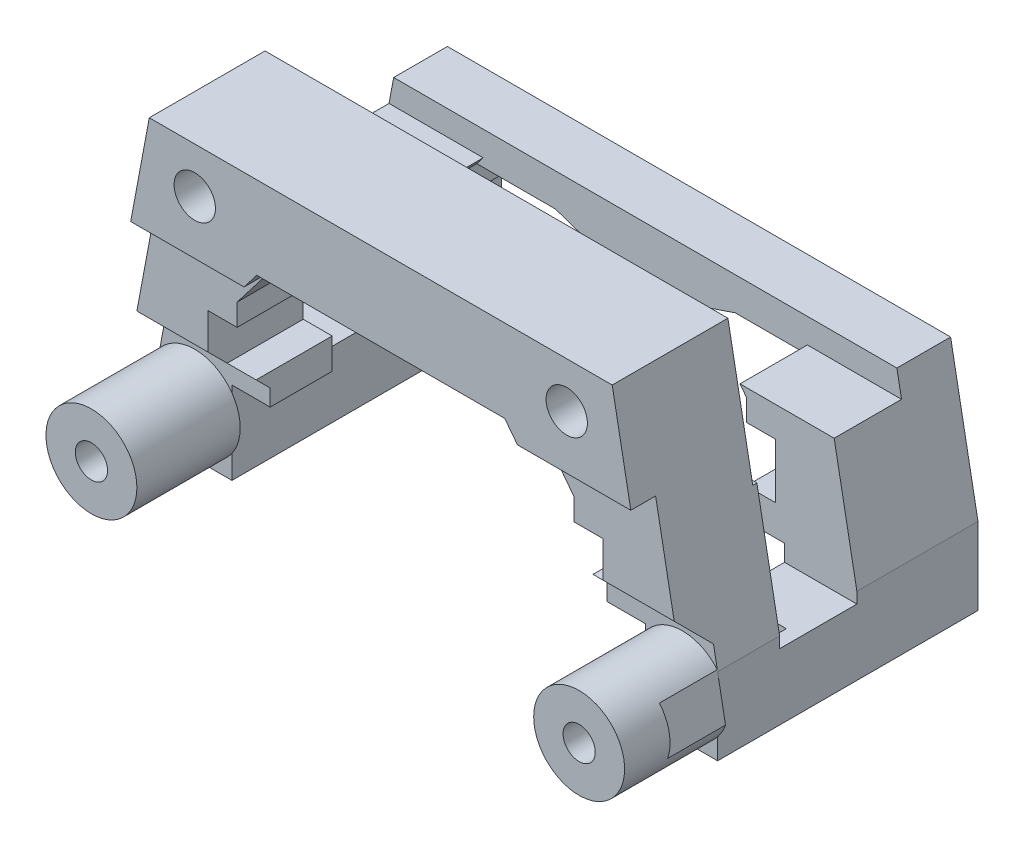
from build123d import *

# Parameters (mm, degrees)
SZKIC1_W                        = 1
SZKIC1_H                        = 32
DODANIE_WYCI_GNI_CIE1_DEPTH     = 67.5
WYTNIJ_WYCI_GNI_CIE1_DEPTH      = 94
WYTNIJ_WYCI_GNI_CIE2_DEPTH      = 36
WYTNIJ_WYCI_GNI_CIE2_DEPTH_BACK = 135
WYTNIJ_WYCI_GNI_CIE6_REACH      = 131.943
SZKIC6_R                        = 5
SZKIC7_R                        = 6.5
WYTNIJ_WYCI_GNI_CIE7_DEPTH      = 20
SZKIC8_R                        = 11
SZKIC8_R_2                      = 3.9
DODANIE_WYCI_GNI_CIE2_DEPTH     = 25
WYTNIJ_WYCI_GNI_CIE8_DEPTH      = 94


with BuildPart() as part:
    # Szkic1 → Dodanie-wyciągnięcie1 (new, symmetric)
    with BuildSketch(Plane(origin=(0, 0, 0), x_dir=(0, 0, -1), z_dir=(1, 0, 0))):
        Polygon((-63, 24), (-71, 32), (-71, 56), (-77, 56), (-77, 80), (-49, 80), (-49, 16), (-29.3, 16), (-29.3, 48), (-13, 48), (-13, 54), (0, 54), (0, 0), (-63, 0), align=None)
        with Locations((-48.5, 32)):
            Rectangle(SZKIC1_W, SZKIC1_H)
    extrude(amount=DODANIE_WYCI_GNI_CIE1_DEPTH, both=True)

    # Szkic2 → Wytnij-wyciągnięcie1 (cut)
    with BuildSketch(Plane(origin=(0, 0, 0), x_dir=(-1, 0, 0), z_dir=(0, 0, -1))):
        Polygon((50, 0), (50, 20), (40.75, 20), (40.75, 27.4), (47.75, 27.4), (47.75, 40.7), (40.75, 40.7), (40.75, 46), (21.75, 46), (10, 42), (-10, 42), (-21.75, 46), (-40.75, 46), (-40.75, 40.7), (-47.75, 40.7), (-47.75, 27.4), (-40.75, 27.4), (-40.75, 20), (-50, 20), (-50, 0), align=None)
    extrude(amount=-WYTNIJ_WYCI_GNI_CIE1_DEPTH, mode=Mode.SUBTRACT)

    # Szkic4 → Wytnij-wyciągnięcie2 (cut, two sides: drawn at the far end of the back side and taken through both)
    with BuildSketch(Plane(origin=(0, 0, 49), x_dir=(-1, 0, 0), z_dir=(0, 0, -1)).offset(-WYTNIJ_WYCI_GNI_CIE2_DEPTH_BACK)):
        Polygon((40.75, 40.7), (40.75, 46), (30, 60), (-30, 60), (-40.75, 46), (-40.75, 40.7), align=None)
    extrude(amount=WYTNIJ_WYCI_GNI_CIE2_DEPTH + WYTNIJ_WYCI_GNI_CIE2_DEPTH_BACK, mode=Mode.SUBTRACT)

    # Szkic6 → Wytnij-wyciągnięcie6 (cut, up to next)
    with BuildSketch(Plane.XY.offset(77), mode=Mode.PRIVATE) as wytnij_wyci_gni_cie6_sk1:
        with Locations((-45, 69)):
            Circle(SZKIC6_R)
    wytnij_wyci_gni_cie6_tool1 = extrude(wytnij_wyci_gni_cie6_sk1.sketch, amount=-WYTNIJ_WYCI_GNI_CIE6_REACH, mode=Mode.PRIVATE) & part.part
    # Szkic6 → Wytnij-wyciągnięcie6 (cut, up to next)
    with BuildSketch(Plane.XY.offset(77), mode=Mode.PRIVATE) as wytnij_wyci_gni_cie6_sk2:
        with Locations(Location((45, 69, 0), (0, 0, 270))):
            Circle(SZKIC6_R)
    wytnij_wyci_gni_cie6_tool2 = extrude(wytnij_wyci_gni_cie6_sk2.sketch, amount=-WYTNIJ_WYCI_GNI_CIE6_REACH, mode=Mode.PRIVATE) & part.part
    add(wytnij_wyci_gni_cie6_tool1.solids().sort_by_distance((-45, 69, 77))[0], mode=Mode.SUBTRACT)
    add(wytnij_wyci_gni_cie6_tool2.solids().sort_by_distance((45, 69, 77))[0], mode=Mode.SUBTRACT)

    # Szkic7 → Wytnij-wyciągnięcie7 (cut)
    with BuildSketch(Plane.XY.offset(63)):
        with Locations((-59, 12)):
            Circle(SZKIC7_R)
        with Locations(Location((59, 12, 0), (0, 0, 37.979872445))):
            Circle(SZKIC7_R)
    extrude(amount=-WYTNIJ_WYCI_GNI_CIE7_DEPTH, mode=Mode.SUBTRACT)

    # Szkic8 → Dodanie-wyciągnięcie2 (add)
    # profile 1 of 2: a face of its own
    with BuildSketch(Plane.XY.offset(63)):
        with Locations(Location((-59, 12, 0), (0, 0, 219.400568754))):
            Circle(SZKIC8_R)
        with Locations((-59, 12)):
            Circle(SZKIC8_R_2, mode=Mode.SUBTRACT)
    # profile 2 of 2: a face of its own
    with BuildSketch(Plane.XY.offset(63)):
        with Locations(Location((59, 12, 0), (0, 0, 180))):
            Circle(SZKIC8_R)
        with Locations(Location((59, 12, 0), (0, 0, 180))):
            Circle(SZKIC8_R_2, mode=Mode.SUBTRACT)
    extrude(amount=DODANIE_WYCI_GNI_CIE2_DEPTH)

    # Szkic9 → Wytnij-wyciągnięcie8 (cut)
    with BuildSketch(Plane.XY.offset(77)):
        Polygon((-71, 0), (-56, 80), (56, 80), (71, 0), (104.197926063, 0), (104.197926063, 108.650562656), (-104.197926063, 108.650562656), (-104.197926063, 0), align=None)
    extrude(amount=-WYTNIJ_WYCI_GNI_CIE8_DEPTH, mode=Mode.SUBTRACT)


solid = part.part
